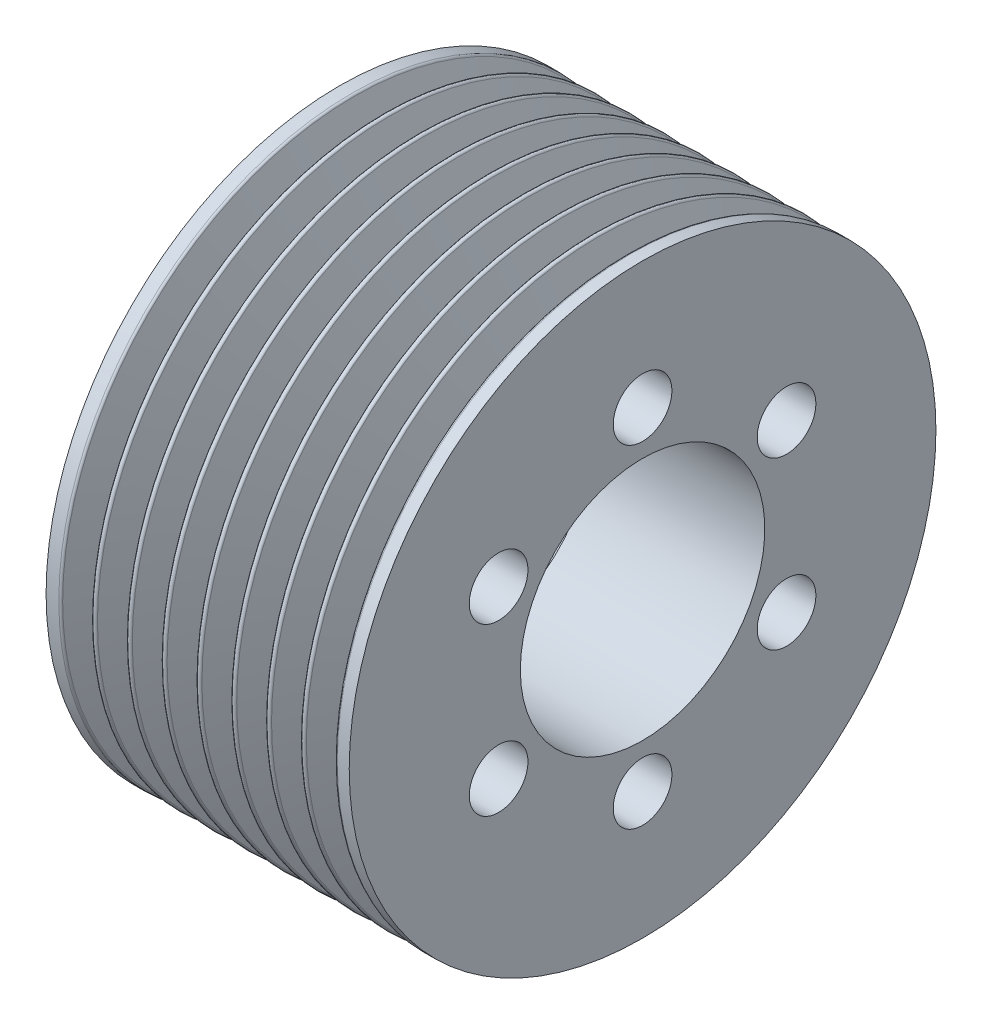
from build123d import *

# Parameters (mm, degrees)
LPATTERN1_COUNT    = 8
LPATTERN1_PITCH    = 3.56
SKETCH3_R          = 3
CUT_EXTRUDE1_DEPTH = 17.5


with BuildPart() as part:
    # Sketch1 → Revolve1 (revolve)
    with BuildSketch(Plane.XY, mode=Mode.PRIVATE) as revolve1_sk:
        Polygon((49, 12.5), (49, 30), (18, 30), (18, 21.5), (31.5, 21.5), (31.5, 12.5), align=None)
    revolve(revolve1_sk.sketch.rotate(Axis((0, 0, 0), (1, 0, 0)), 90), axis=Axis((0, 0, 0), (1, 0, 0)))

    # Sketch2 → Cut-Revolve1 (revolve, cut)
    with BuildSketch(Plane.XY, mode=Mode.PRIVATE) as cut_revolve1_sk:
        with BuildLine():
            Line((47.545831953, 29.837551845), (46.281001657, 26.45460955))
            ThreePointArc((46.281001657, 26.45460955), (46, 26.259671764), (45.718998343, 26.45460955))
            Line((45.718998343, 26.45460955), (44.454168047, 29.837551845))
            ThreePointArc((44.454168047, 29.837551845), (44.362499191, 29.955411734), (44.22, 30))
            Line((44.22, 30), (47.78, 30))
            ThreePointArc((47.78, 30), (47.637500809, 29.955411734), (47.545831953, 29.837551845))
        make_face()
    cut_revolve1 = revolve(cut_revolve1_sk.sketch.rotate(Axis((0, 0, 0), (1, 0, 0)), 90), axis=Axis((0, 0, 0), (1, 0, 0)), mode=Mode.SUBTRACT)

    # LPattern1: Cut-Revolve1 ×8
    with Locations(*[(-i * LPATTERN1_PITCH, 0, 0) for i in range(1, LPATTERN1_COUNT)]):
        add(cut_revolve1, mode=Mode.SUBTRACT)

    # Sketch3 → Cut-Extrude1 (cut)
    with BuildSketch(Plane(origin=(49, 0, 0), x_dir=(0, 0, -1), z_dir=(1, 0, 0))):
        with Locations((0, 17)):
            Circle(SKETCH3_R)
        with Locations((14.722431864, 8.5)):
            Circle(SKETCH3_R)
        with Locations((14.722431864, -8.5)):
            Circle(SKETCH3_R)
        with Locations((0, -17)):
            Circle(SKETCH3_R)
        with Locations((-14.722431864, -8.5)):
            Circle(SKETCH3_R)
        with Locations((-14.722431864, 8.5)):
            Circle(SKETCH3_R)
    extrude(amount=-CUT_EXTRUDE1_DEPTH, mode=Mode.SUBTRACT)


solid = part.part
